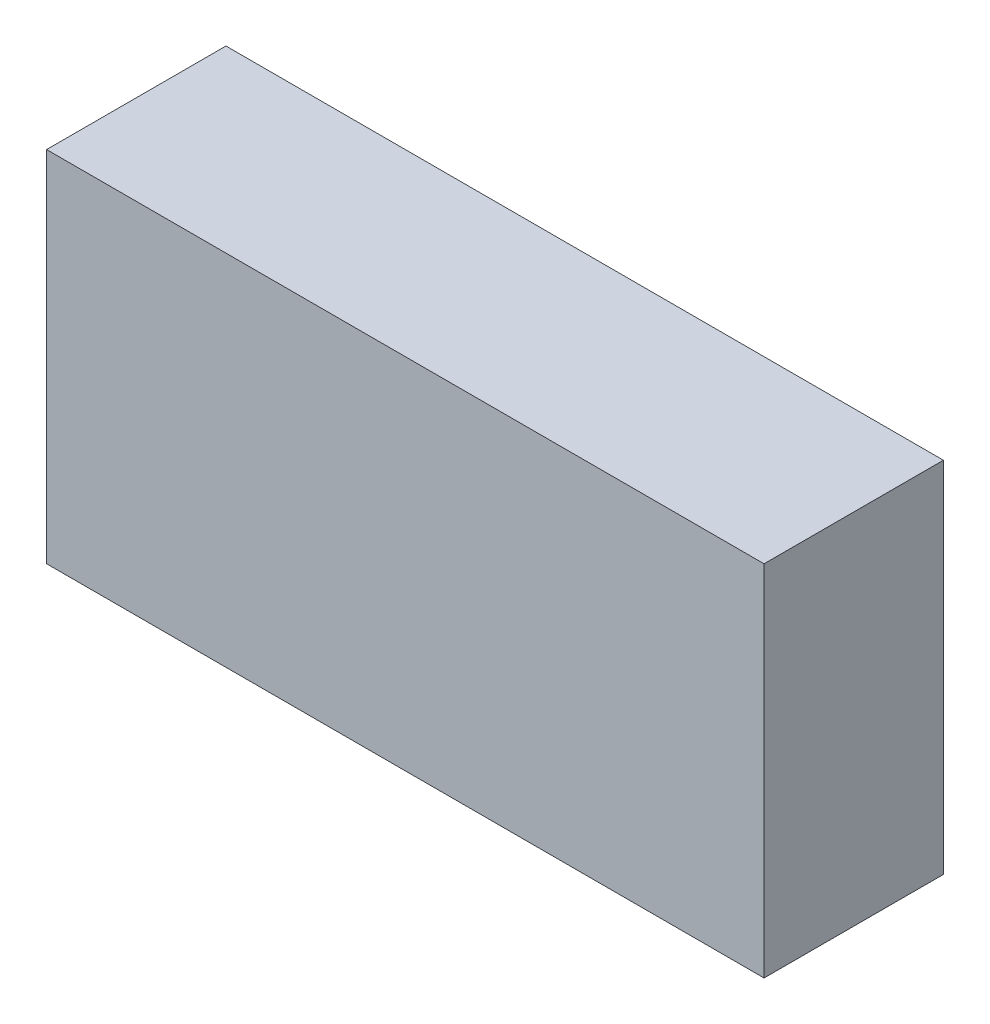
from build123d import *

# Parameters (mm, degrees)
SKETCH1_W           = 40
SKETCH1_H           = 20
BOSS_EXTRUDE1_DEPTH = 10
SKETCH2_W           = 4
SKETCH2_H           = 4
BOSS_EXTRUDE2_DEPTH = 5


with BuildPart() as part:
    # Sketch1 → Boss-Extrude1 (new body)
    with BuildSketch(Plane.XY):
        with Locations((20, 10)):
            Rectangle(SKETCH1_W, SKETCH1_H)
    extrude(amount=BOSS_EXTRUDE1_DEPTH)

    # Sketch2 → Boss-Extrude2 (add)
    with BuildSketch(Plane(origin=(0, 0, 0), x_dir=(-1, 0, 0), z_dir=(0, 0, -1))):
        with Locations((-20, 10)):
            Rectangle(SKETCH2_W, SKETCH2_H)
    extrude(amount=BOSS_EXTRUDE2_DEPTH)


solid = part.part
